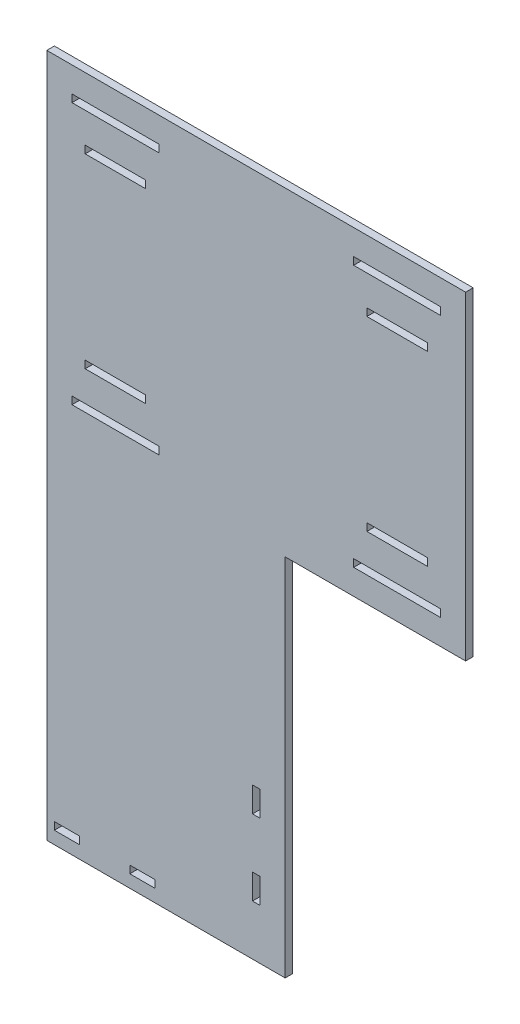
from build123d import *

# Parameters (mm, degrees)
SKETCH1_W           = 333
SKETCH1_H           = 544
SKETCH1_W_2         = 48
SKETCH1_H_2         = 6
SKETCH1_W_3         = 69
SKETCH1_W_4         = 6
SKETCH1_H_3         = 20
SKETCH1_W_5         = 20
BOSS_EXTRUDE1_DEPTH = 6
SKETCH2_W           = 143.5
SKETCH2_H           = 290
CUT_EXTRUDE1_DEPTH  = 6


with BuildPart() as part:
    # Sketch1 → Boss-Extrude1 (new body)
    with BuildSketch(Plane.XY):
        with Locations((27.644903204, -172)):
            Rectangle(SKETCH1_W, SKETCH1_H)
        with Locations((139.644903204, 47)):
            Rectangle(SKETCH1_W_2, SKETCH1_H_2, mode=Mode.SUBTRACT)
        with Locations((139.644903204, 77)):
            Rectangle(SKETCH1_W_3, SKETCH1_H_2, mode=Mode.SUBTRACT)
        with Locations((139.644903204, -101)):
            Rectangle(SKETCH1_W_2, SKETCH1_H_2, mode=Mode.SUBTRACT)
        with Locations((139.644903204, -131)):
            Rectangle(SKETCH1_W_3, SKETCH1_H_2, mode=Mode.SUBTRACT)
        with Locations((-84.355096796, 77)):
            Rectangle(SKETCH1_W_3, SKETCH1_H_2, mode=Mode.SUBTRACT)
        with Locations((-84.355096796, 47)):
            Rectangle(SKETCH1_W_2, SKETCH1_H_2, mode=Mode.SUBTRACT)
        with Locations((-84.355096796, -101)):
            Rectangle(SKETCH1_W_2, SKETCH1_H_2, mode=Mode.SUBTRACT)
        with Locations((-84.355096796, -131)):
            Rectangle(SKETCH1_W_3, SKETCH1_H_2, mode=Mode.SUBTRACT)
        with Locations((27.644903204, -394)):
            Rectangle(SKETCH1_W_4, SKETCH1_H_3, mode=Mode.SUBTRACT)
        with Locations((27.644903204, -334)):
            Rectangle(SKETCH1_W_4, SKETCH1_H_3, mode=Mode.SUBTRACT)
        with Locations((-62.855096796, -431)):
            Rectangle(SKETCH1_W_5, SKETCH1_H_2, mode=Mode.SUBTRACT)
        with Locations((-122.855096796, -431)):
            Rectangle(SKETCH1_W_5, SKETCH1_H_2, mode=Mode.SUBTRACT)
    extrude(amount=BOSS_EXTRUDE1_DEPTH)

    # Sketch2 → Cut-Extrude1 (cut)
    with BuildSketch(Plane.XY.offset(6)):
        with Locations((122.394903204, -299)):
            Rectangle(SKETCH2_W, SKETCH2_H)
    extrude(amount=-CUT_EXTRUDE1_DEPTH, mode=Mode.SUBTRACT)


solid = part.part
